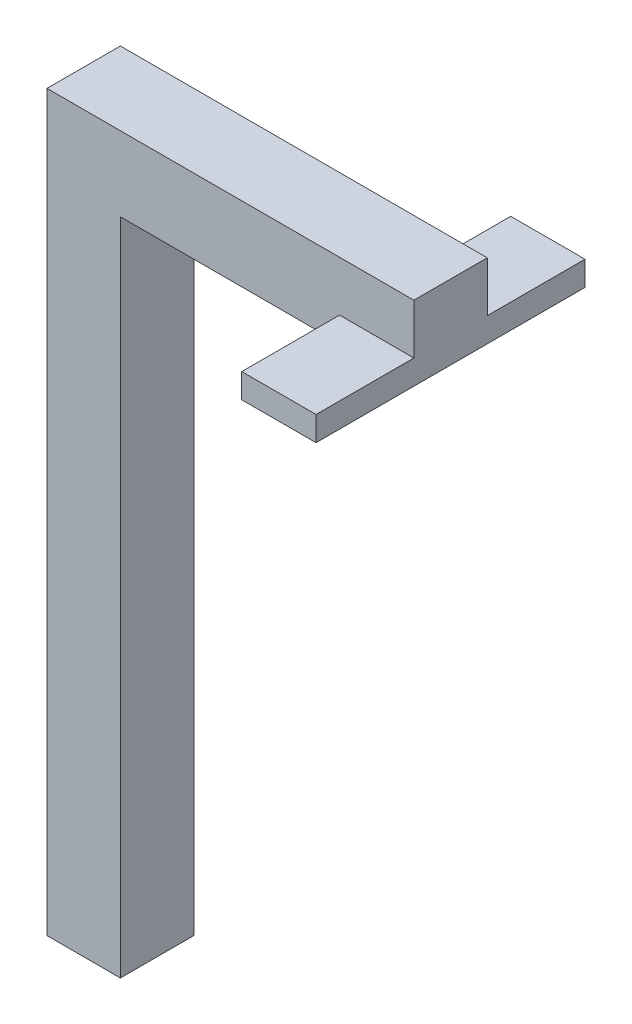
from build123d import *

# Parameters (mm, degrees)
SKETCH1_W           = 7.62
SKETCH1_H           = 76.2
BOSS_EXTRUDE1_DEPTH = 7.62
SKETCH3_W           = 7.62
SKETCH3_H           = 7.740164582
BOSS_EXTRUDE3_DEPTH = 30.48
BOSS_EXTRUDE4_DEPTH = 2.54


with BuildPart() as part:
    # Sketch1 → Boss-Extrude1 (new body)
    with BuildSketch(Plane.XY):
        with Locations((3.81, 38.1)):
            Rectangle(SKETCH1_W, SKETCH1_H)
    extrude(amount=BOSS_EXTRUDE1_DEPTH)

    # Sketch3 → Boss-Extrude3 (add)
    with BuildSketch(Plane(origin=(7.62, 0, 0), x_dir=(0, 0, -1), z_dir=(1, 0, 0))):
        with Locations((-3.81, 72.329917709)):
            Rectangle(SKETCH3_W, SKETCH3_H)
    extrude(amount=BOSS_EXTRUDE3_DEPTH)

    # Sketch6 → Boss-Extrude4 (add)
    with BuildSketch(Plane(origin=(0, 68.459835418, 0), x_dir=(-1, 0, 0), z_dir=(0, -1, 0))):
        Polygon((-38.1, -7.62), (-38.1, -17.78), (-30.382577063, -17.78), (-30.382577063, 10.150655404), (-38.1, 10.150655404), (-38.1, 0), align=None)
    extrude(amount=-BOSS_EXTRUDE4_DEPTH)


solid = part.part
